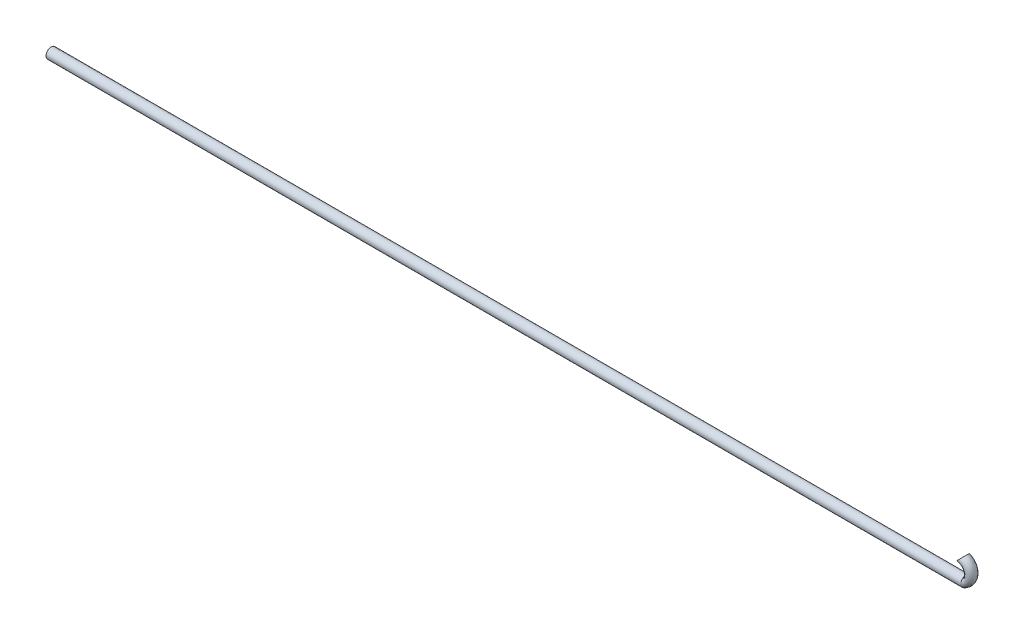
from build123d import *

# Parameters (mm, degrees)
SKETCH1_R           = 0.6223
SKETCH1_R_2         = 0.51435
BOSS_EXTRUDE1_DEPTH = 110
SKETCH3_R           = 0.6223
SKETCH3_R_2         = 0.51435


with BuildPart() as part:
    # Sketch1 → Boss-Extrude1 (new body)
    with BuildSketch(Plane(origin=(0, 0, 0), x_dir=(0, 0, -1), z_dir=(1, 0, 0))):
        Circle(SKETCH1_R)
        Circle(SKETCH1_R_2, mode=Mode.SUBTRACT)
    extrude(amount=BOSS_EXTRUDE1_DEPTH)

    # Sweep1: sweep along a path in Sketch2
    with BuildLine(Plane.XY) as sweep1_path:
        ThreePointArc((110, 0), (110.603682456, 1.279010883), (109.649907133, 2.323335536))
    # Sketch3 → Sweep1 (sweep)
    with BuildSketch(Plane(origin=(110, 0, 0), x_dir=(0, 0, -1), z_dir=(1, 0, 0))):
        Circle(SKETCH3_R)
        Circle(SKETCH3_R_2, mode=Mode.SUBTRACT)
    sweep(path=sweep1_path.line)


solid = part.part
